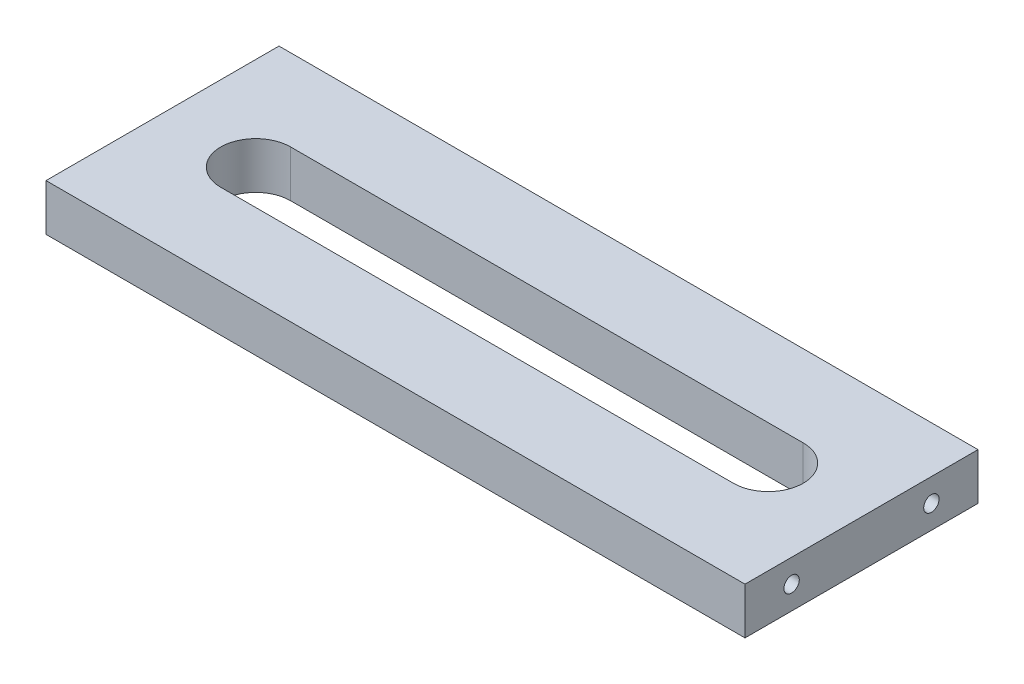
from build123d import *

# Parameters (mm, degrees)
SKETCH_1_W                       = 150
SKETCH_1_H                       = 50
EXTRUDE_1_DEPTH                  = 10
CUT_EXTRUDE_1_DEPTH              = 10
HOLE_WIZARD_M4_1_D               = 3.3
HOLE_WIZARD_M4_1_DEPTH           = 7
HOLE_WIZARD_M4_1_TIP             = 0.991420021
HOLE_WIZARD_M4_2_D               = 3.3
HOLE_WIZARD_M4_2_DEPTH           = 7
HOLE_WIZARD_M4_2_TIP             = 0.991420021
HOLE_WIZARD_M4_2_ON_FACE_2_D     = 3.3
HOLE_WIZARD_M4_2_ON_FACE_2_DEPTH = 7
HOLE_WIZARD_M4_2_ON_FACE_2_TIP   = 0.991420021


with BuildPart() as part:
    # 草图1 → 凸台-拉伸1 (new body)
    with BuildSketch(Plane(origin=(0, 0, 0), x_dir=(1, 0, 0), z_dir=(0, 1, 0))):
        Rectangle(SKETCH_1_W, SKETCH_1_H)
    extrude(amount=EXTRUDE_1_DEPTH)

    # 草图2 → 切除-拉伸1 (cut)
    with BuildSketch(Plane(origin=(0, 10, 0), x_dir=(1, 0, 0), z_dir=(0, 1, 0))):
        with BuildLine():
            Line((-55, 7.5), (55, 7.5))
            ThreePointArc((55, 7.5), (62.5, 0), (55, -7.5))
            Line((55, -7.5), (-55, -7.5))
            ThreePointArc((-55, -7.5), (-62.5, 0), (-55, 7.5))
        make_face()
    extrude(amount=-CUT_EXTRUDE_1_DEPTH, mode=Mode.SUBTRACT)

    # M4 螺纹孔的螺纹孔钻头1
    with Locations(Plane(origin=(-75, 5, -15), x_dir=(0, 0, -1), z_dir=(-1, 0, 0))):
        with Locations((0, 0), (-30, 0)):
            Hole(HOLE_WIZARD_M4_1_D / 2, depth=HOLE_WIZARD_M4_1_DEPTH)
            with Locations((0, 0, -(HOLE_WIZARD_M4_1_DEPTH + HOLE_WIZARD_M4_1_TIP / 2))):  # 118° drill point
                Cone(0, HOLE_WIZARD_M4_1_D / 2, HOLE_WIZARD_M4_1_TIP, mode=Mode.SUBTRACT)

    # M4 螺纹孔的螺纹孔钻头2
    with Locations(Plane(origin=(75, 5, 15), x_dir=(0, 0, 1), z_dir=(1, 0, 0))):
        with Locations((0, 0), (-30, 0)):
            Hole(HOLE_WIZARD_M4_2_D / 2, depth=HOLE_WIZARD_M4_2_DEPTH)
            with Locations((0, 0, -(HOLE_WIZARD_M4_2_DEPTH + HOLE_WIZARD_M4_2_TIP / 2))):  # 118° drill point
                Cone(0, HOLE_WIZARD_M4_2_D / 2, HOLE_WIZARD_M4_2_TIP, mode=Mode.SUBTRACT)

    # M4 螺纹孔的螺纹孔钻头2 on face 2
    with Locations(Plane(origin=(0, 37.698562119, 89.96356162), x_dir=(0, 0, 1), z_dir=(1, 0, 0))):
        with Locations((0, 0)):
            Hole(HOLE_WIZARD_M4_2_ON_FACE_2_D / 2, depth=HOLE_WIZARD_M4_2_ON_FACE_2_DEPTH)
            with Locations((0, 0, -(HOLE_WIZARD_M4_2_ON_FACE_2_DEPTH + HOLE_WIZARD_M4_2_ON_FACE_2_TIP / 2))):  # 118° drill point
                Cone(0, HOLE_WIZARD_M4_2_ON_FACE_2_D / 2, HOLE_WIZARD_M4_2_ON_FACE_2_TIP, mode=Mode.SUBTRACT)


solid = part.part
